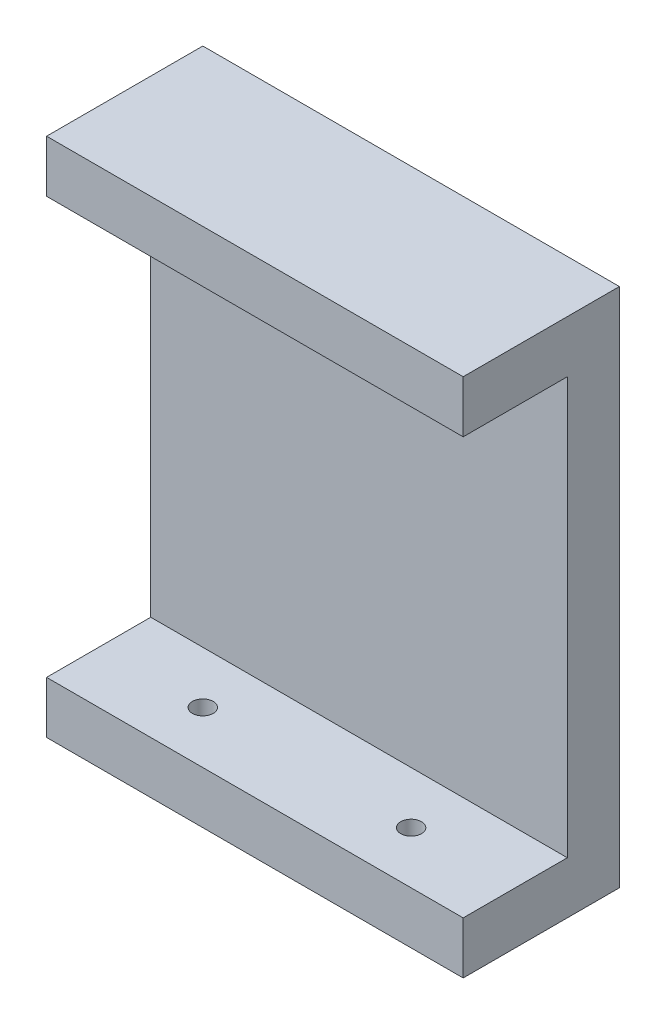
from build123d import *

# Parameters (mm, degrees)
SKETCH1_W               = 80
SKETCH1_H               = 100
BOSS_EXTRUDE1_DEPTH     = 10
SKETCH2_R               = 4
CUT_EXTRUDE1_DEPTH      = 7
SKETCH3_W               = 80
SKETCH3_H               = 10
BOSS_EXTRUDE2_DEPTH     = 20
CUT_EXTRUDE2_DEPTH      = 85
CUT_EXTRUDE2_DEPTH_BACK = 5
SKETCH4_R               = 2


with BuildPart() as part:
    # Sketch1 → Boss-Extrude1 (new body)
    with BuildSketch(Plane.XY):
        Rectangle(SKETCH1_W, SKETCH1_H)
    extrude(amount=BOSS_EXTRUDE1_DEPTH)

    # Sketch2 → Cut-Extrude1 (cut)
    with BuildSketch(Plane(origin=(0, 0, 0), x_dir=(-1, 0, 0), z_dir=(0, 0, -1))):
        with Locations((-30, -20)):
            Circle(SKETCH2_R)
        with Locations(Location((30, -20, 0), (0, 0, 180))):
            Circle(SKETCH2_R)
    extrude(amount=-CUT_EXTRUDE1_DEPTH, mode=Mode.SUBTRACT)

    # Sketch3 → Boss-Extrude2 (add)
    with BuildSketch(Plane.XY.offset(10)):
        with Locations((0, -45)):
            Rectangle(SKETCH3_W, SKETCH3_H)
        with Locations((0, 45)):
            Rectangle(SKETCH3_W, SKETCH3_H)
    extrude(amount=BOSS_EXTRUDE2_DEPTH)

    # Sketch4 → Cut-Extrude2 (cut, two sides: drawn at the far end of the back side and taken through both)
    with BuildSketch(Plane(origin=(0, -40, 0), x_dir=(1, 0, 0), z_dir=(0, 1, 0)).offset(-CUT_EXTRUDE2_DEPTH_BACK)):
        with Locations(Location((-20, -20, 0), (0, 0, 270))):
            Circle(SKETCH4_R)
        with Locations(Location((20, -20, 0), (0, 0, 270))):
            Circle(SKETCH4_R)
    extrude(amount=CUT_EXTRUDE2_DEPTH + CUT_EXTRUDE2_DEPTH_BACK, mode=Mode.SUBTRACT)


solid = part.part
